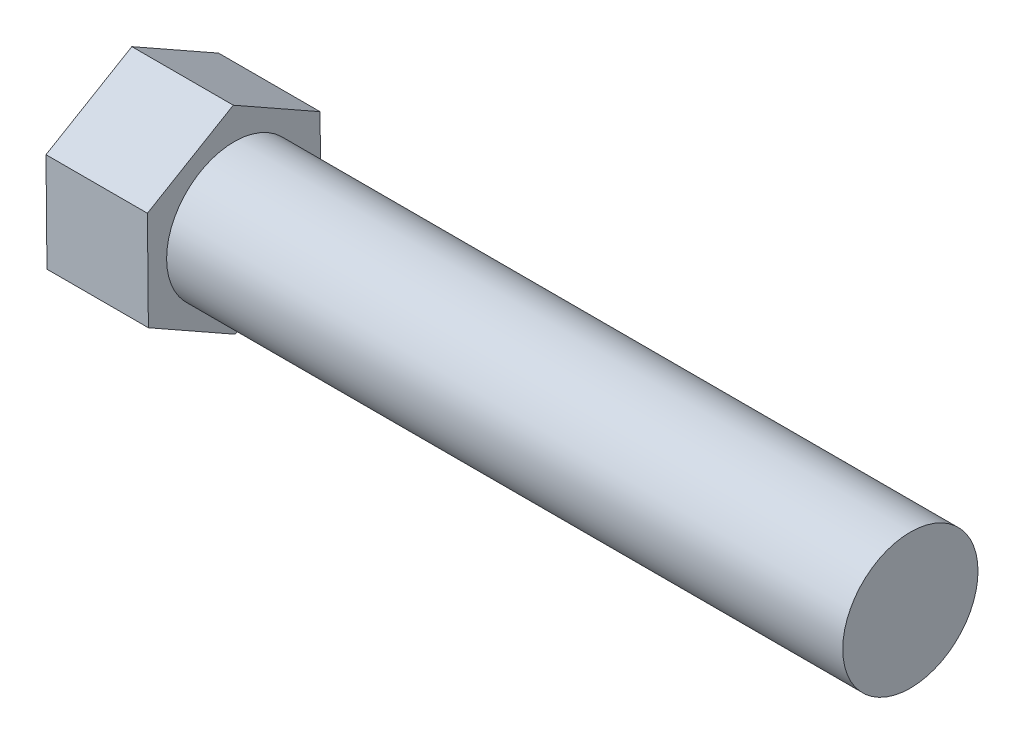
from build123d import *

# Parameters (mm, degrees)
SKETCH_1_R      = 4
EXTRUDE_1_DEPTH = 40
EXTRUDE_2_DEPTH = 6


with BuildPart() as part:
    # Эскиз1 → Бобышка-Вытянуть1 (new body)
    with BuildSketch(Plane(origin=(0, 0, 0), x_dir=(0, 0, -1), z_dir=(1, 0, 0))):
        Circle(SKETCH_1_R)
    extrude(amount=EXTRUDE_1_DEPTH)

    # Эскиз2 → Бобышка-Вытянуть2 (add)
    with BuildSketch(Plane.ZY):
        Polygon((5.077977553, -2.996795631), (5.134289923, 2.899259745), (0.05631237, 5.896055377), (-5.077977553, 2.996795631), (-5.134289923, -2.899259745), (-0.05631237, -5.896055377), align=None)
    extrude(amount=EXTRUDE_2_DEPTH)


solid = part.part
